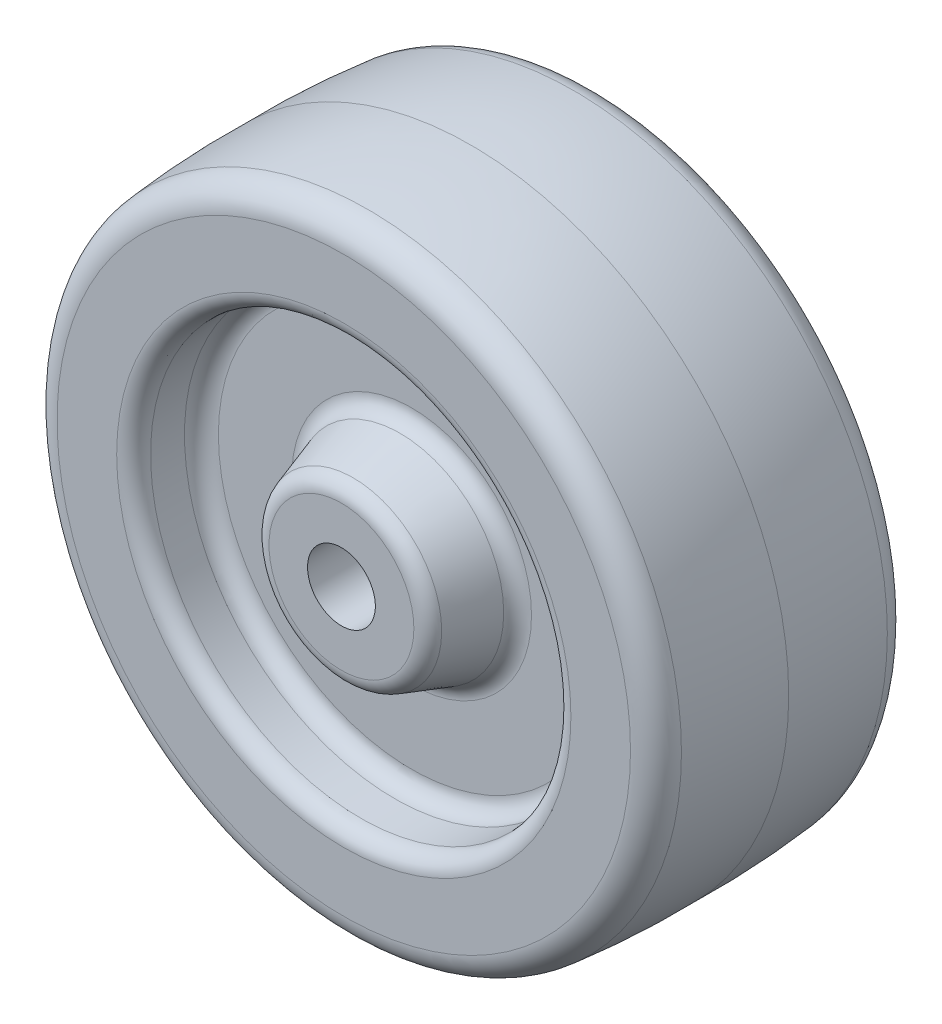
from build123d import *

# Parameters (mm, degrees)
ESBO_O1_R             = 4
CORTE_EXTRUS_O1_DEPTH = 94.722971268


with BuildPart() as part:
    # Sketch8 → Revolve2 (revolve)
    with BuildSketch(Plane(origin=(0, 0, 0), x_dir=(0, 0, -1), z_dir=(1, 0, 0)), mode=Mode.PRIVATE) as revolve2_sk:
        with BuildLine():
            Line((-15.277651946, -42.751036358), (15.277651946, -42.751036358))
            Line((15.277651946, -42.751036358), (15.277651946, -51.299690881))
            ThreePointArc((15.277651946, -51.299690881), (14.896355184, -52.474339692), (13.897852117, -53.201098715))
            Line((13.897852117, -53.201098715), (8.379799829, -55.000974002))
            ThreePointArc((8.379799829, -55.000974002), (7.381296763, -55.727733024), (7, -56.902381835))
            Line((7, -56.902381835), (7, -65.551036358))
            ThreePointArc((7, -65.551036358), (7.585786438, -66.965249921), (9, -67.551036358))
            Line((9, -67.551036358), (13, -67.551036358))
            ThreePointArc((13, -67.551036358), (14.414213562, -68.136822796), (15, -69.551036358))
            Line((15, -69.551036358), (15, -76.584414663))
            ThreePointArc((15, -76.584414663), (14.181185625, -78.712562755), (12.147077606, -79.743036358))
            ThreePointArc((12.147077606, -79.743036358), (6.081138229, -80.17875056), (0, -80.251036358))
            ThreePointArc((0, -80.251036358), (-6.081138229, -80.17875056), (-12.147077606, -79.743036358))
            ThreePointArc((-12.147077606, -79.743036358), (-14.181185625, -78.712562755), (-15, -76.584414663))
            Line((-15, -76.584414663), (-15, -69.551036358))
            ThreePointArc((-15, -69.551036358), (-14.414213562, -68.136822796), (-13, -67.551036358))
            Line((-13, -67.551036358), (-9, -67.551036358))
            ThreePointArc((-9, -67.551036358), (-7.585786438, -66.965249921), (-7, -65.551036358))
            Line((-7, -65.551036358), (-7, -56.902381835))
            ThreePointArc((-7, -56.902381835), (-7.381296763, -55.727733024), (-8.379799829, -55.000974002))
            Line((-8.379799829, -55.000974002), (-13.897852117, -53.201098715))
            ThreePointArc((-13.897852117, -53.201098715), (-14.896355184, -52.474339692), (-15.277651946, -51.299690881))
            Line((-15.277651946, -51.299690881), (-15.277651946, -42.751036358))
        make_face()
    revolve(revolve2_sk.sketch.rotate(Axis((0, -42.751036358, 15.277651946), (0, 0, -1)), 270), axis=Axis((0, -42.751036358, 15.277651946), (0, 0, -1)))

    # Esboço1 → Corte-extrusão1 (cut, through all)
    with BuildSketch(Plane(origin=(0, 0, -15.277651946), x_dir=(-1, 0, 0), z_dir=(0, 0, -1))):
        with Locations((0, -42.751036358)):
            Circle(ESBO_O1_R)
    extrude(amount=-CORTE_EXTRUS_O1_DEPTH, mode=Mode.SUBTRACT)


solid = part.part
